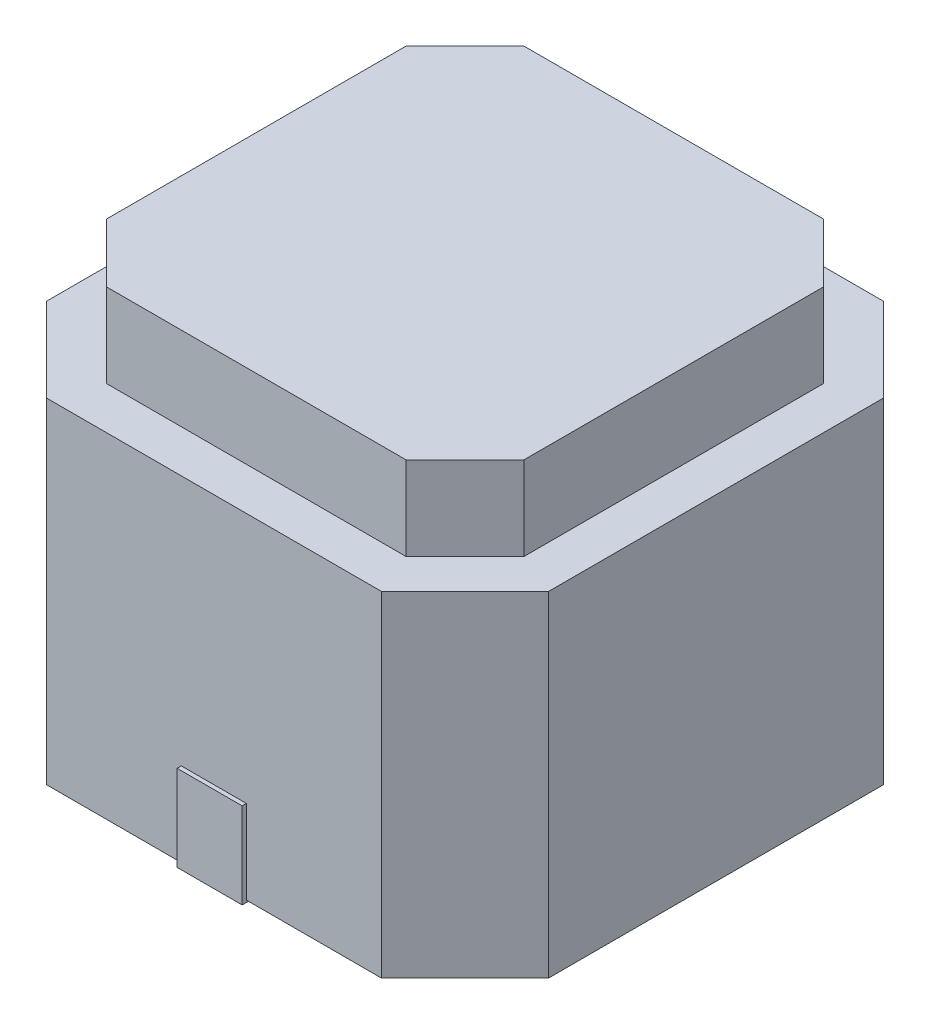
from build123d import *

# Parameters (mm, degrees)
BOSS_EXTRUDE1_DEPTH      = 5
CUT_EXTRUDE1_DEPTH       = 1
BOSS_EXTRUDE2_DEPTH      = 0.0254
BOSS_EXTRUDE2_DEPTH_BACK = 1
SKETCH3_W                = 0.777152918
SKETCH3_H                = 1.679205413


with BuildPart() as part:
    # Sketch1 → Boss-Extrude1 (new body)
    with BuildSketch(Plane(origin=(0, 0, 0), x_dir=(1, 0, 0), z_dir=(0, 1, 0))):
        Polygon((-3, 2), (-2, 3), (2, 3), (3, 2), (3, -2), (2, -3), (-2, -3), (-3, -2), align=None)
    extrude(amount=BOSS_EXTRUDE1_DEPTH)

    # Sketch2 → Cut-Extrude1 (cut)
    with BuildSketch(Plane(origin=(0, 5, 0), x_dir=(1, 0, 0), z_dir=(0, 1, 0))):
        Polygon((3, -2), (3, 2), (2, 3), (-2, 3), (-3, 2), (-3, -2), (-2, -3), (2, -3), align=None)
        Polygon((2.492, -1.78957951), (2.492, 1.78957951), (1.78957951, 2.492), (-1.78957951, 2.492), (-2.492, 1.78957951), (-2.492, -1.78957951), (-1.78957951, -2.492), (1.78957951, -2.492), align=None, mode=Mode.SUBTRACT)
    extrude(amount=-CUT_EXTRUDE1_DEPTH, mode=Mode.SUBTRACT)

    # Sketch3 → Boss-Extrude2 (add, two sides: drawn at the far end of the back side and taken through both)
    with BuildSketch(Plane.XZ.offset(-BOSS_EXTRUDE2_DEPTH_BACK)):
        with Locations((0, 2.210397294)):
            Rectangle(SKETCH3_W, SKETCH3_H)
        with Locations((0, -2.210397294)):
            Rectangle(SKETCH3_W, SKETCH3_H)
    extrude(amount=BOSS_EXTRUDE2_DEPTH + BOSS_EXTRUDE2_DEPTH_BACK)


solid = part.part
